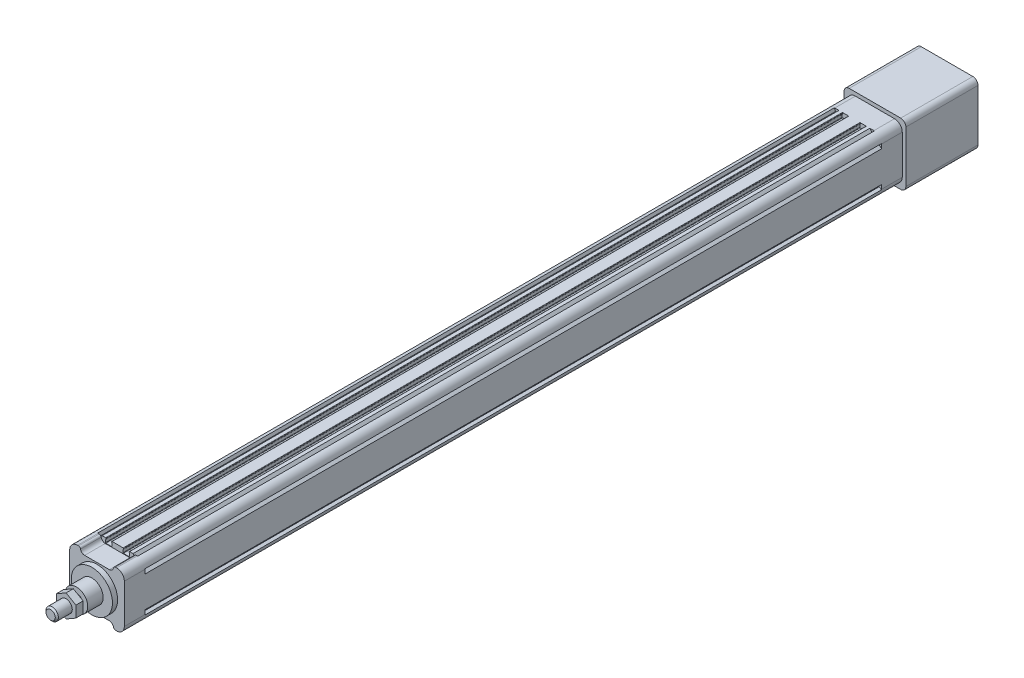
from build123d import *

# Parameters (mm, degrees)
SKETCH_1_R             = 2.1
EXTRUDE_1_DEPTH        = 715
EXTRUDE_2_DEPTH        = 20
SKETCH_7_R             = 20
EXTRUDE_3_DEPTH        = 5
SKETCH_9_R             = 11
EXTRUDE_4_DEPTH        = 15
SKETCH_10_R            = 6
EXTRUDE_5_DEPTH        = 25
EXTRUDE_START          = 20
EXTRUDE_6_DEPTH        = 20
EXTRUDE_7_DEPTH        = 70
SKETCH_14_R            = 19
CUT_EXTRUDE_2_DEPTH    = 70
HOLE_WIZARD_M6_1_D     = 5
HOLE_WIZARD_M6_1_DEPTH = 15
HOLE_WIZARD_M6_1_TIP   = 1.502151548
CHAMFER_1_SIZE         = 1.5
EXTRUDE_START_2        = 3
EXTRUDE_8_DEPTH        = 7


with BuildPart() as part:
    # 草图1 → 凸台-拉伸1 (new body)
    with BuildSketch(Plane.XY):
        with BuildLine():
            Line((-18.2, 24), (-19.443439638, 26.486879276))
            ThreePointArc((-19.443439638, 26.486879276), (-24.303300859, 24.303300859), (-26.486879276, 19.443439638))
            Line((-26.486879276, 19.443439638), (-24, 18.2))
            Line((-24, 18.2), (-24, 17.1))
            Line((-24, 17.1), (-26.5, 15))
            Line((-26.5, 15), (-26.5, -15))
            Line((-26.5, -15), (-24, -17.1))
            Line((-24, -17.1), (-24, -18.2))
            Line((-24, -18.2), (-26.486879276, -19.443439638))
            ThreePointArc((-26.486879276, -19.443439638), (-24.303300859, -24.303300859), (-19.443439638, -26.486879276))
            Line((-19.443439638, -26.486879276), (-18.2, -24))
            Line((-18.2, -24), (-17.1, -24))
            Line((-17.1, -24), (-15, -26.5))
            Line((-15, -26.5), (-11.65, -26.5))
            ThreePointArc((-11.65, -26.5), (-11.367157288, -26.382842712), (-11.25, -26.1))
            Line((-11.25, -26.1), (-11.25, -25.6))
            ThreePointArc((-11.25, -25.6), (-11.367157288, -25.317157288), (-11.65, -25.2))
            Line((-11.65, -25.2), (-11.75, -25.2))
            Line((-11.75, -25.2), (-11.75, -22.4))
            ThreePointArc((-11.75, -22.4), (-11.632842712, -22.117157288), (-11.35, -22))
            Line((-11.35, -22), (-5.65, -22))
            ThreePointArc((-5.65, -22), (-5.367157288, -22.117157288), (-5.25, -22.4))
            Line((-5.25, -22.4), (-5.25, -25.2))
            Line((-5.25, -25.2), (-5.35, -25.2))
            ThreePointArc((-5.35, -25.2), (-5.632842712, -25.317157288), (-5.75, -25.6))
            Line((-5.75, -25.6), (-5.75, -26.1))
            ThreePointArc((-5.75, -26.1), (-5.632842712, -26.382842712), (-5.35, -26.5))
            Line((-5.35, -26.5), (5.35, -26.5))
            ThreePointArc((5.35, -26.5), (5.632842712, -26.382842712), (5.75, -26.1))
            Line((5.75, -26.1), (5.75, -25.6))
            ThreePointArc((5.75, -25.6), (5.632842712, -25.317157288), (5.35, -25.2))
            Line((5.35, -25.2), (5.25, -25.2))
            Line((5.25, -25.2), (5.25, -22.4))
            ThreePointArc((5.25, -22.4), (5.367157288, -22.117157288), (5.65, -22))
            Line((5.65, -22), (11.35, -22))
            ThreePointArc((11.35, -22), (11.632842712, -22.117157288), (11.75, -22.4))
            Line((11.75, -22.4), (11.75, -25.2))
            Line((11.75, -25.2), (11.65, -25.2))
            ThreePointArc((11.65, -25.2), (11.367157288, -25.317157288), (11.25, -25.6))
            Line((11.25, -25.6), (11.25, -26.1))
            ThreePointArc((11.25, -26.1), (11.367157288, -26.382842712), (11.65, -26.5))
            Line((11.65, -26.5), (15, -26.5))
            Line((15, -26.5), (17.1, -24))
            Line((17.1, -24), (18.2, -24))
            Line((18.2, -24), (19.443439638, -26.486879276))
            ThreePointArc((19.443439638, -26.486879276), (24.303300859, -24.303300859), (26.486879276, -19.443439638))
            Line((26.486879276, -19.443439638), (24, -18.2))
            Line((24, -18.2), (24, -17.1))
            Line((24, -17.1), (26.5, -15))
            Line((26.5, -15), (26.5, 15))
            Line((26.5, 15), (24, 17.1))
            Line((24, 17.1), (24, 18.2))
            Line((24, 18.2), (26.486879276, 19.443439638))
            ThreePointArc((26.486879276, 19.443439638), (24.303300859, 24.303300859), (19.443439638, 26.486879276))
            Line((19.443439638, 26.486879276), (18.2, 24))
            Line((18.2, 24), (17.1, 24))
            Line((17.1, 24), (15, 26.5))
            Line((15, 26.5), (11.65, 26.5))
            ThreePointArc((11.65, 26.5), (11.367157288, 26.382842712), (11.25, 26.1))
            Line((11.25, 26.1), (11.25, 25.6))
            ThreePointArc((11.25, 25.6), (11.367157288, 25.317157288), (11.65, 25.2))
            Line((11.65, 25.2), (11.75, 25.2))
            Line((11.75, 25.2), (11.75, 22.4))
            ThreePointArc((11.75, 22.4), (11.632842712, 22.117157288), (11.35, 22))
            Line((11.35, 22), (5.65, 22))
            ThreePointArc((5.65, 22), (5.367157288, 22.117157288), (5.25, 22.4))
            Line((5.25, 22.4), (5.25, 25.2))
            Line((5.25, 25.2), (5.35, 25.2))
            ThreePointArc((5.35, 25.2), (5.632842712, 25.317157288), (5.75, 25.6))
            Line((5.75, 25.6), (5.75, 26.1))
            ThreePointArc((5.75, 26.1), (5.632842712, 26.382842712), (5.35, 26.5))
            Line((5.35, 26.5), (-5.35, 26.5))
            ThreePointArc((-5.35, 26.5), (-5.632842712, 26.382842712), (-5.75, 26.1))
            Line((-5.75, 26.1), (-5.75, 25.6))
            ThreePointArc((-5.75, 25.6), (-5.632842712, 25.317157288), (-5.35, 25.2))
            Line((-5.35, 25.2), (-5.25, 25.2))
            Line((-5.25, 25.2), (-5.25, 22.4))
            ThreePointArc((-5.25, 22.4), (-5.367157288, 22.117157288), (-5.65, 22))
            Line((-5.65, 22), (-11.35, 22))
            ThreePointArc((-11.35, 22), (-11.632842712, 22.117157288), (-11.75, 22.4))
            Line((-11.75, 22.4), (-11.75, 25.2))
            Line((-11.75, 25.2), (-11.65, 25.2))
            ThreePointArc((-11.65, 25.2), (-11.367157288, 25.317157288), (-11.25, 25.6))
            Line((-11.25, 25.6), (-11.25, 26.1))
            ThreePointArc((-11.25, 26.1), (-11.367157288, 26.382842712), (-11.65, 26.5))
            Line((-11.65, 26.5), (-15, 26.5))
            Line((-15, 26.5), (-17.1, 24))
            Line((-17.1, 24), (-18.2, 24))
        make_face()
        with Locations((19, 19)):
            Circle(SKETCH_1_R, mode=Mode.SUBTRACT)
        with Locations((19, -19)):
            Circle(SKETCH_1_R, mode=Mode.SUBTRACT)
        with Locations((-19, -19)):
            Circle(SKETCH_1_R, mode=Mode.SUBTRACT)
        with Locations((-19, 19)):
            Circle(SKETCH_1_R, mode=Mode.SUBTRACT)
        with BuildLine():
            Line((19.773719933, 3), (23.3, 3))
            Line((23.3, 3), (23.3, -3))
            Line((23.3, -3), (19.773719933, -3))
            ThreePointArc((19.773719933, -3), (0, -20), (-19.773719933, -3))
            Line((-19.773719933, -3), (-23.3, -3))
            Line((-23.3, -3), (-23.3, 3))
            Line((-23.3, 3), (-19.773719933, 3))
            ThreePointArc((-19.773719933, 3), (0, 20), (19.773719933, 3))
        make_face(mode=Mode.SUBTRACT)
    extrude(amount=EXTRUDE_1_DEPTH)

    # 草图6 → 凸台-拉伸2 (add)
    with BuildSketch(Plane.XY.offset(715)):
        with BuildLine():
            Line((-26.5, -19), (-26.5, 19))
            ThreePointArc((-26.5, 19), (-24.303300859, 24.303300859), (-19, 26.5))
            Line((-19, 26.5), (-17.916079783, 26.5))
            ThreePointArc((-17.916079783, 26.5), (-16.625085334, 26.027525232), (-15.944053189, 24.833333333))
            ThreePointArc((-15.944053189, 24.833333333), (-14.581988897, 22.444949537), (-12, 21.5))
            Line((-12, 21.5), (12, 21.5))
            ThreePointArc((12, 21.5), (14.581988897, 22.444949537), (15.944053189, 24.833333333))
            ThreePointArc((15.944053189, 24.833333333), (16.625085334, 26.027525232), (17.916079783, 26.5))
            Line((17.916079783, 26.5), (19, 26.5))
            ThreePointArc((19, 26.5), (24.303300859, 24.303300859), (26.5, 19))
            Line((26.5, 19), (26.5, -19))
            ThreePointArc((26.5, -19), (24.303300859, -24.303300859), (19, -26.5))
            Line((19, -26.5), (17.916079783, -26.5))
            ThreePointArc((17.916079783, -26.5), (16.625085334, -26.027525232), (15.944053189, -24.833333333))
            ThreePointArc((15.944053189, -24.833333333), (14.581988897, -22.444949537), (12, -21.5))
            Line((12, -21.5), (-12, -21.5))
            ThreePointArc((-12, -21.5), (-14.581988897, -22.444949537), (-15.944053189, -24.833333333))
            ThreePointArc((-15.944053189, -24.833333333), (-16.625085334, -26.027525232), (-17.916079783, -26.5))
            Line((-17.916079783, -26.5), (-19, -26.5))
            ThreePointArc((-19, -26.5), (-24.303300859, -24.303300859), (-26.5, -19))
        make_face()
    extrude(amount=EXTRUDE_2_DEPTH)

    # 草图7 → 凸台-拉伸3 (add)
    with BuildSketch(Plane.XY.offset(735)):
        Circle(SKETCH_7_R)
    extrude(amount=EXTRUDE_3_DEPTH)

    # 草图9 → 凸台-拉伸4 (add)
    with BuildSketch(Plane.XY.offset(740)):
        Circle(SKETCH_9_R)
    extrude(amount=EXTRUDE_4_DEPTH)

    # 草图10 → 凸台-拉伸5 (add)
    with BuildSketch(Plane.XY.offset(755)):
        Circle(SKETCH_10_R)
    extrude(amount=EXTRUDE_5_DEPTH)

    # 草图11 → 凸台-拉伸6 (add)
    with BuildSketch(Plane(origin=(0, 0, 0), x_dir=(-1, 0, 0), z_dir=(0, 0, -1)).offset(EXTRUDE_START)):
        with BuildLine():
            Line((-19, -26.5), (19, -26.5))
            ThreePointArc((19, -26.5), (24.303300859, -24.303300859), (26.5, -19))
            Line((26.5, -19), (26.5, 19))
            ThreePointArc((26.5, 19), (24.303300859, 24.303300859), (19, 26.5))
            Line((19, 26.5), (-19, 26.5))
            ThreePointArc((-19, 26.5), (-24.303300859, 24.303300859), (-26.5, 19))
            Line((-26.5, 19), (-26.5, -19))
            ThreePointArc((-26.5, -19), (-24.303300859, -24.303300859), (-19, -26.5))
        make_face()
    extrude(amount=-EXTRUDE_6_DEPTH)

    # 草图12 → 凸台-拉伸7 (add)
    with BuildSketch(Plane(origin=(0, 0, -20), x_dir=(-1, 0, 0), z_dir=(0, 0, -1))):
        with BuildLine():
            Line((-25, -30), (25, -30))
            ThreePointArc((25, -30), (28.535533906, -28.535533906), (30, -25))
            Line((30, -25), (30, 25))
            ThreePointArc((30, 25), (28.535533906, 28.535533906), (25, 30))
            Line((25, 30), (-25, 30))
            ThreePointArc((-25, 30), (-28.535533906, 28.535533906), (-30, 25))
            Line((-30, 25), (-30, -25))
            ThreePointArc((-30, -25), (-28.535533906, -28.535533906), (-25, -30))
        make_face()
    extrude(amount=EXTRUDE_7_DEPTH)

    # 草图14 → 切除-拉伸2 (cut)
    with BuildSketch(Plane(origin=(0, 0, -90), x_dir=(-1, 0, 0), z_dir=(0, 0, -1))):
        Circle(SKETCH_14_R)
    extrude(amount=-CUT_EXTRUDE_2_DEPTH, mode=Mode.SUBTRACT)

    # M6 螺纹孔1
    with Locations(Plane.ZY.offset(26.5)):
        with Locations((725, 11), (725, -11), (-10, 11), (-10, -11)):
            Hole(HOLE_WIZARD_M6_1_D / 2, depth=HOLE_WIZARD_M6_1_DEPTH)
            with Locations((0, 0, -(HOLE_WIZARD_M6_1_DEPTH + HOLE_WIZARD_M6_1_TIP / 2))):  # 118° drill point
                Cone(0, HOLE_WIZARD_M6_1_D / 2, HOLE_WIZARD_M6_1_TIP, mode=Mode.SUBTRACT)

    # 倒角1
    chamfer_1_edges = [part.edges().sort_by_distance(p)[0] for p in [
        (-6, 0, 780),
    ]]
    chamfer(chamfer_1_edges, length=CHAMFER_1_SIZE)

    # 草图17 → 凸台-拉伸8 (add)
    with BuildSketch(Plane.XY.offset(755).offset(EXTRUDE_START_2)):
        Polygon((0, 10.969655115), (-9.5, 5.484827557), (-9.5, -5.484827557), (0, -10.969655115), (9.5, -5.484827557), (9.5, 5.484827557), align=None)
    extrude(amount=EXTRUDE_8_DEPTH)


solid = part.part
